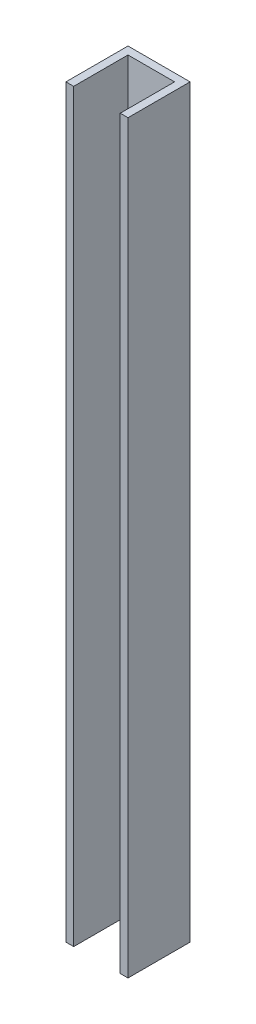
from build123d import *

# Parameters (mm, degrees)
BOSS_EXTRUDE1_DEPTH = 300


with BuildPart() as part:
    # Sketch1 → Boss-Extrude1 (new body)
    with BuildSketch(Plane(origin=(0, 0, 0), x_dir=(1, 0, 0), z_dir=(0, 1, 0))):
        Polygon((0, 0), (0, 25), (25, 25), (25, 0), (21.875, 0), (21.875, 21.875), (3.125, 21.875), (3.125, 0), align=None)
    extrude(amount=BOSS_EXTRUDE1_DEPTH)


solid = part.part
